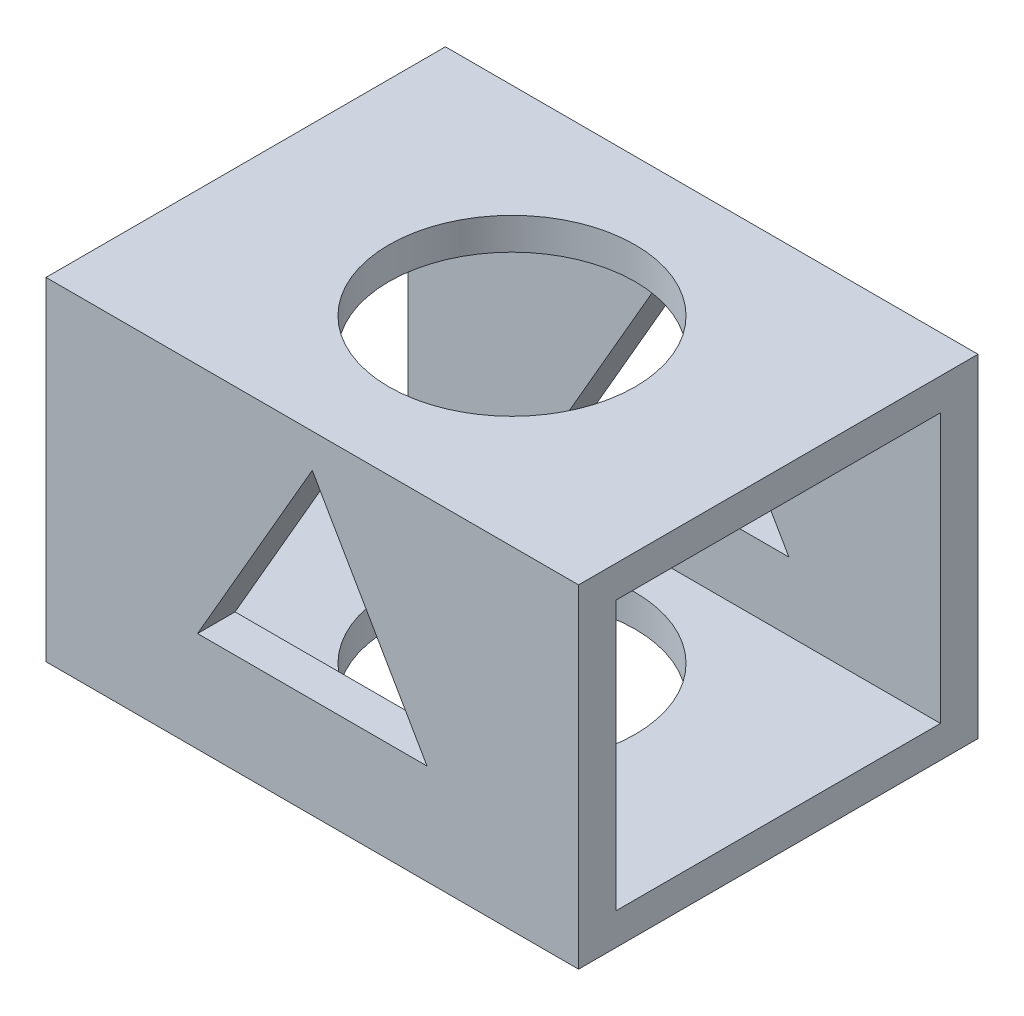
from build123d import *

# Parameters (mm, degrees)
SKETCH1_W           = 203.2
SKETCH1_H           = 127
BOSS_EXTRUDE1_DEPTH = 76.2
CUT_EXTRUDE1_DEPTH  = 194.857086535
SKETCH3_W           = 123.769027692
SKETCH3_H           = 102.663904472
CUT_EXTRUDE2_DEPTH  = 227.117071448
SKETCH4_R           = 46.960856135
CUT_EXTRUDE3_DEPTH  = 180.605122421


with BuildPart() as part:
    # Sketch1 → Boss-Extrude1 (new, symmetric)
    with BuildSketch(Plane.XY):
        Rectangle(SKETCH1_W, SKETCH1_H)
    extrude(amount=BOSS_EXTRUDE1_DEPTH, both=True)

    # Sketch2 → Cut-Extrude1 (cut, through all)
    with BuildSketch(Plane.XY.offset(76.2)):
        Polygon((0, 50.550598249), (-43.77810226, -25.275299124), (43.77810226, -25.275299124), align=None)
    extrude(amount=-CUT_EXTRUDE1_DEPTH, mode=Mode.SUBTRACT)

    # Sketch3 → Cut-Extrude2 (cut, through all)
    with BuildSketch(Plane(origin=(101.6, 0, 0), x_dir=(0, 0, -1), z_dir=(1, 0, 0))):
        Rectangle(SKETCH3_W, SKETCH3_H)
    extrude(amount=-CUT_EXTRUDE2_DEPTH, mode=Mode.SUBTRACT)

    # Sketch4 → Cut-Extrude3 (cut, through all)
    with BuildSketch(Plane(origin=(0, 63.5, 0), x_dir=(1, 0, 0), z_dir=(0, 1, 0))):
        with Locations(Location((0, 0, 0), (0, 0, 270))):
            Circle(SKETCH4_R)
    extrude(amount=-CUT_EXTRUDE3_DEPTH, mode=Mode.SUBTRACT)


solid = part.part
